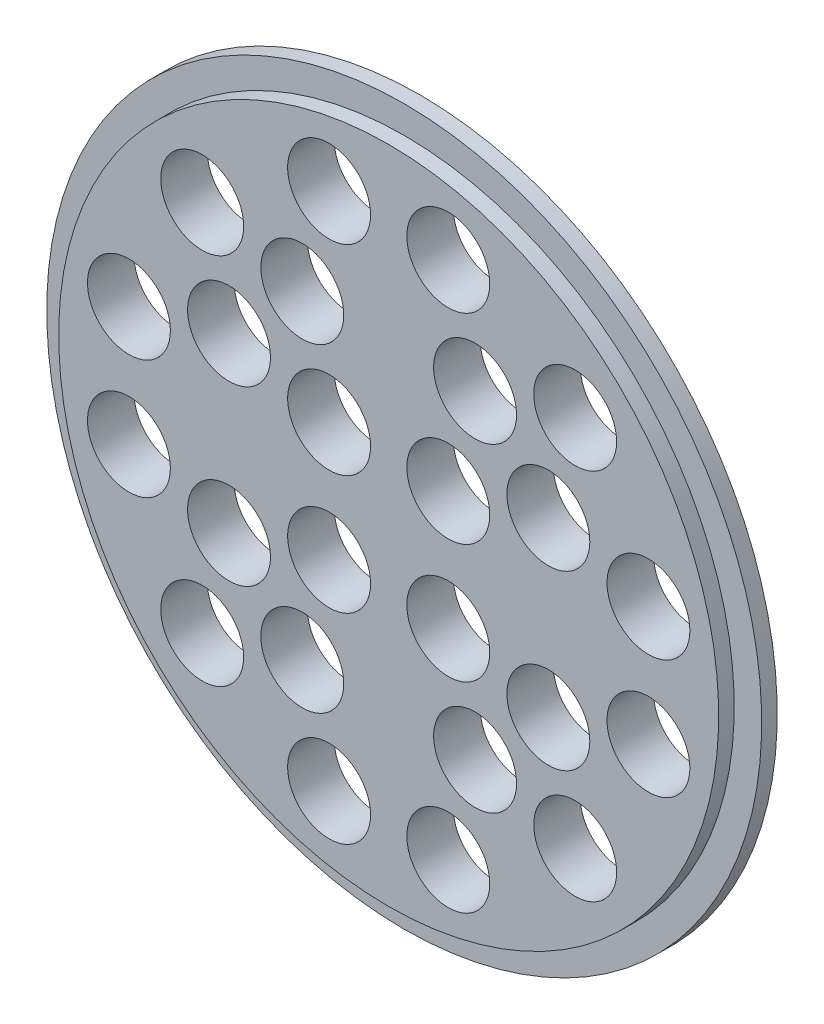
from build123d import *

# Parameters (mm, degrees)
SKETCH1_R               = 34.5
SKETCH1_R_2             = 4
BOSS_EXTRUDE1_DEPTH     = 4.5
SKETCH2_W               = 1.5
SKETCH2_H               = 2.65
CUT_EXTRUDE1_DEPTH      = 49.997448913
CUT_EXTRUDE1_DEPTH_BACK = 49.997448913
SKETCH4_W               = 1.55
SKETCH4_H               = 1.5


with BuildPart() as part:
    # Sketch1 → Boss-Extrude1 (new body)
    with BuildSketch(Plane.XY):
        Circle(SKETCH1_R)
        with Locations((5.75, 5.75)):
            Circle(SKETCH1_R_2, mode=Mode.SUBTRACT)
        with Locations((8.338190451, 15.409258263)):
            Circle(SKETCH1_R_2, mode=Mode.SUBTRACT)
        with Locations((17.997448714, 17.997448714)):
            Circle(SKETCH1_R_2, mode=Mode.SUBTRACT)
        with Locations((15.409258263, 8.338190451)):
            Circle(SKETCH1_R_2, mode=Mode.SUBTRACT)
        with Locations((25.068516526, 5.75)):
            Circle(SKETCH1_R_2, mode=Mode.SUBTRACT)
        with Locations((5.75, 25.068516526)):
            Circle(SKETCH1_R_2, mode=Mode.SUBTRACT)
        with Locations((25.068556101, -5.749960425)):
            Circle(SKETCH1_R_2, mode=Mode.SUBTRACT)
        with Locations((15.409297838, -8.338150876)):
            Circle(SKETCH1_R_2, mode=Mode.SUBTRACT)
        with Locations((17.997488289, -17.997409139)):
            Circle(SKETCH1_R_2, mode=Mode.SUBTRACT)
        with Locations((8.338230026, -15.409218688)):
            Circle(SKETCH1_R_2, mode=Mode.SUBTRACT)
        with Locations((5.750039575, -25.068476951)):
            Circle(SKETCH1_R_2, mode=Mode.SUBTRACT)
        with Locations((5.750039575, -5.749960425)):
            Circle(SKETCH1_R_2, mode=Mode.SUBTRACT)
        with Locations((-5.74992085, -25.068516526)):
            Circle(SKETCH1_R_2, mode=Mode.SUBTRACT)
        with Locations((-8.338111301, -15.409258263)):
            Circle(SKETCH1_R_2, mode=Mode.SUBTRACT)
        with Locations((-17.997369564, -17.997448714)):
            Circle(SKETCH1_R_2, mode=Mode.SUBTRACT)
        with Locations((-15.409179113, -8.338190451)):
            Circle(SKETCH1_R_2, mode=Mode.SUBTRACT)
        with Locations((-25.068437376, -5.75)):
            Circle(SKETCH1_R_2, mode=Mode.SUBTRACT)
        with Locations((-5.74992085, -5.75)):
            Circle(SKETCH1_R_2, mode=Mode.SUBTRACT)
        with Locations((-25.068476951, 5.749960425)):
            Circle(SKETCH1_R_2, mode=Mode.SUBTRACT)
        with Locations((-15.409218688, 8.338150876)):
            Circle(SKETCH1_R_2, mode=Mode.SUBTRACT)
        with Locations((-17.997409139, 17.997409139)):
            Circle(SKETCH1_R_2, mode=Mode.SUBTRACT)
        with Locations((-8.338150876, 15.409218688)):
            Circle(SKETCH1_R_2, mode=Mode.SUBTRACT)
        with Locations((-5.749960425, 25.068476951)):
            Circle(SKETCH1_R_2, mode=Mode.SUBTRACT)
        with Locations((-5.749960425, 5.749960425)):
            Circle(SKETCH1_R_2, mode=Mode.SUBTRACT)
    extrude(amount=BOSS_EXTRUDE1_DEPTH)

    # Sketch2 → Cut-Revolve1 (revolve, cut)
    with BuildSketch(Plane(origin=(0, 0, 0), x_dir=(0, 0, -1), z_dir=(1, 0, 0))):
        with Locations((-0.75, 33.175)):
            Rectangle(SKETCH2_W, SKETCH2_H)
        with Locations((-3.75, 33.175)):
            Rectangle(SKETCH2_W, SKETCH2_H)
    revolve(axis=Axis((0, 0, 0), (0, 0, 1)), mode=Mode.SUBTRACT)

    # Sketch4 → Cut-Extrude1 (cut, two sides: drawn at the far end of the back side and taken through both)
    with BuildSketch(Plane(origin=(0, 0, 0), x_dir=(1, 0, 0), z_dir=(0, 1, 0)).offset(-CUT_EXTRUDE1_DEPTH_BACK)):
        with Locations((0, -0.75)):
            Rectangle(SKETCH4_W, SKETCH4_H)
    extrude(amount=CUT_EXTRUDE1_DEPTH + CUT_EXTRUDE1_DEPTH_BACK, mode=Mode.SUBTRACT)


solid = part.part
